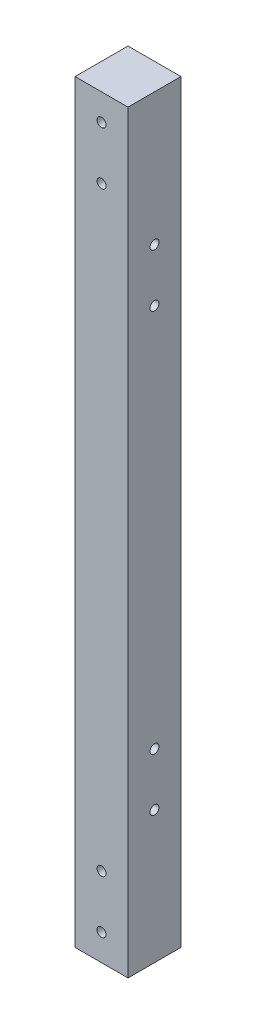
from build123d import *

# Parameters (mm, degrees)
SKETCH_1_W          = 20
SKETCH_1_H          = 20
EXTRUDE_1_DEPTH     = 285
SKETCH_2_R          = 1.7
CUT_EXTRUDE_1_DEPTH = 287.400069832
SKETCH_3_R          = 1.7
CUT_EXTRUDE_2_DEPTH = 287.400069832


with BuildPart() as part:
    # 草图1 → 凸台-拉伸1 (new body)
    with BuildSketch(Plane(origin=(0, 0, 0), x_dir=(1, 0, 0), z_dir=(0, 1, 0))):
        with Locations((10, 10)):
            Rectangle(SKETCH_1_W, SKETCH_1_H)
    extrude(amount=EXTRUDE_1_DEPTH)

    # 草图2 → 切除-拉伸1 (cut, through all)
    with BuildSketch(Plane.XY):
        with Locations((10, 275)):
            Circle(SKETCH_2_R)
        with Locations((10, 255)):
            Circle(SKETCH_2_R)
        with Locations((10, 30)):
            Circle(SKETCH_2_R)
        with Locations((10, 10)):
            Circle(SKETCH_2_R)
    extrude(amount=-CUT_EXTRUDE_1_DEPTH, mode=Mode.SUBTRACT)

    # 草图3 → 切除-拉伸2 (cut, through all)
    with BuildSketch(Plane(origin=(20, 0, 0), x_dir=(0, 0, -1), z_dir=(1, 0, 0))):
        with Locations((10, 235)):
            Circle(SKETCH_3_R)
        with Locations((10, 215)):
            Circle(SKETCH_3_R)
        with Locations((10, 50)):
            Circle(SKETCH_3_R)
        with Locations((10, 70)):
            Circle(SKETCH_3_R)
    extrude(amount=-CUT_EXTRUDE_2_DEPTH, mode=Mode.SUBTRACT)


solid = part.part
